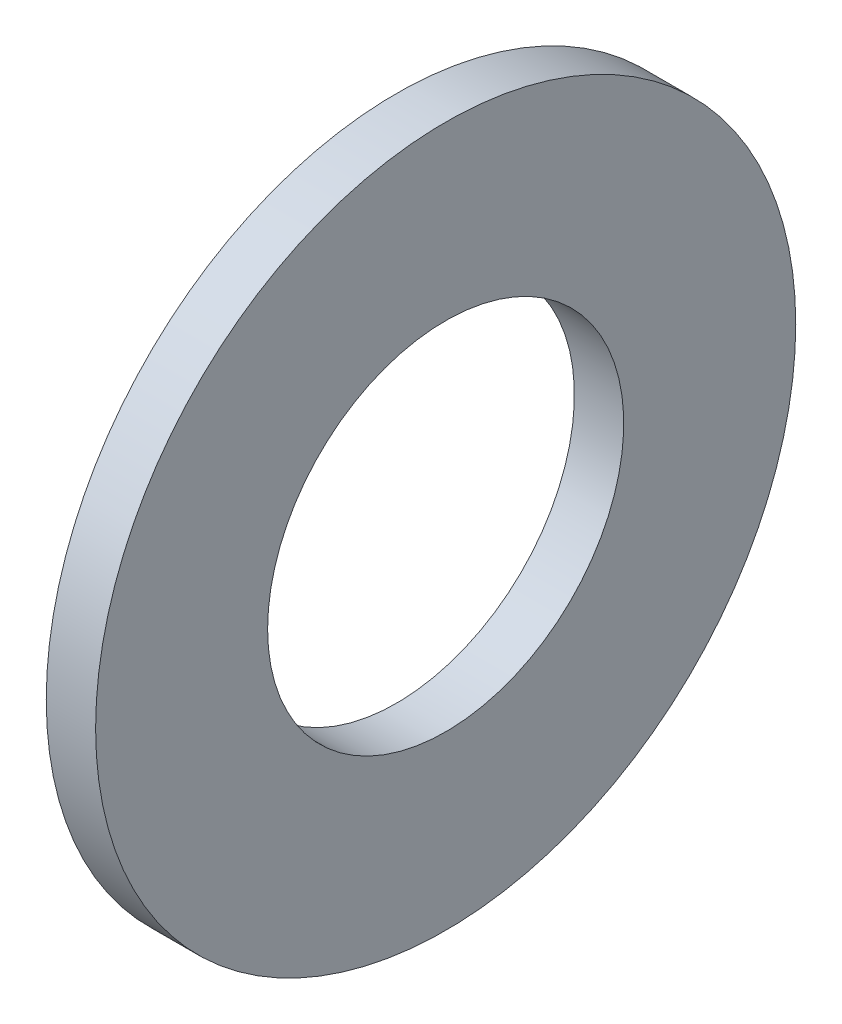
from build123d import *

# Parameters (mm, degrees)
SKETCH1_W = 1.651
SKETCH1_H = 5.7531


with BuildPart() as part:
    # Sketch1 → Base-Revolve (revolve)
    with BuildSketch(Plane.XY, mode=Mode.PRIVATE) as base_revolve_sk:
        with Locations((-0.8255, 8.83285)):
            Rectangle(SKETCH1_W, SKETCH1_H)
    revolve(base_revolve_sk.sketch.rotate(Axis((-34.925, 0, 0), (1, 0, 0)), 90), axis=Axis((-34.925, 0, 0), (1, 0, 0)))


solid = part.part
